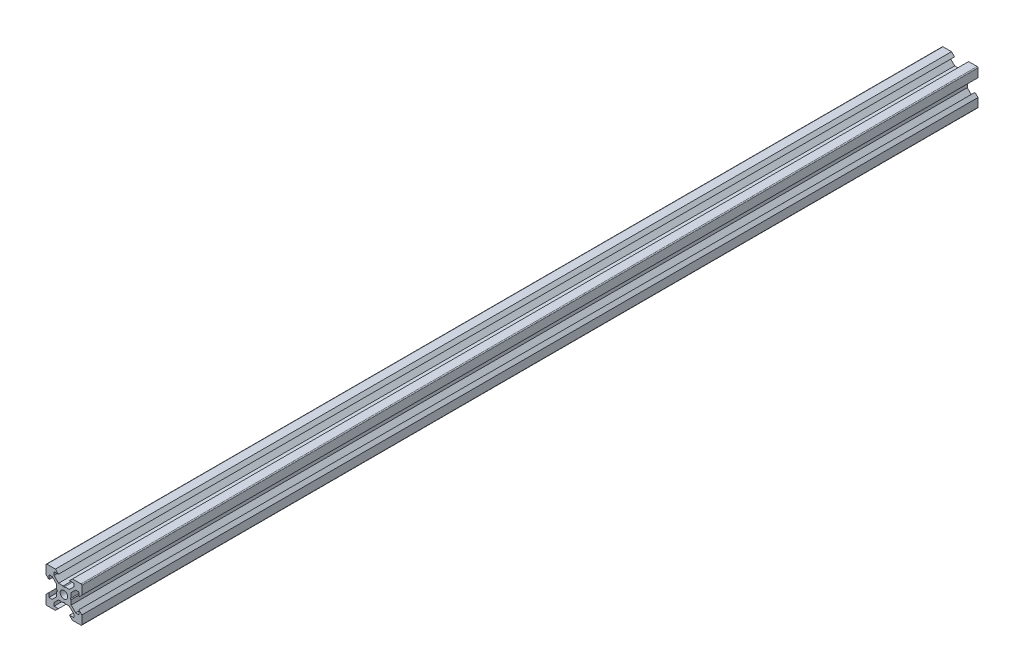
from build123d import *

# Parameters (mm, degrees)
SKETCH1_R           = 2.1
BOSS_EXTRUDE1_DEPTH = 500
FILLET1_R           = 0.5
CUT_EXTRUDE1_DEPTH  = 501.199960016


with BuildPart() as part:
    # Sketch1 → Boss-Extrude1 (new body)
    with BuildSketch(Plane.XY):
        Polygon((-10, 10), (-4.775, 10), (-3.1, 8.325), (-5.5, 8.325), (-5.5, 6.525), (-3, 4.025), (3, 4.025), (5.5, 6.525), (5.5, 8.325), (3.1, 8.325), (4.775, 10), (10, 10), (10, 4.775), (8.325, 3.1), (8.325, 5.5), (6.525, 5.5), (4.025, 3), (4.025, -3), (6.525, -5.5), (8.325, -5.5), (8.325, -3.1), (10, -4.775), (10, -10), (4.775, -10), (3.1, -8.325), (5.5, -8.325), (5.5, -6.525), (3, -4.025), (-3, -4.025), (-5.5, -6.525), (-5.5, -8.325), (-3.1, -8.325), (-4.775, -10), (-10, -10), (-10, -4.775), (-8.325, -3.1), (-8.325, -5.5), (-6.525, -5.5), (-4.025, -3), (-4.025, 3), (-6.525, 5.5), (-8.325, 5.5), (-8.325, 3.1), (-10, 4.775), align=None)
        Circle(SKETCH1_R, mode=Mode.SUBTRACT)
    extrude(amount=BOSS_EXTRUDE1_DEPTH)

    # Fillet1
    fillet1_edges = [part.edges().sort_by_distance(p)[0] for p in [
        (10, -10, 250),
        (-10, -10, 250),
        (-10, 10, 250),
        (10, 10, 250),
    ]]
    fillet(fillet1_edges, radius=FILLET1_R)

    # Sketch2 → Cut-Extrude1 (cut, through all)
    with BuildSketch(Plane.XY.offset(500)):
        with BuildLine():
            ThreePointArc((-4.025, 0.4), (-4.425, 0), (-4.025, -0.4))
            Line((-4.025, -0.4), (-4.025, 0.4))
        make_face()
        with BuildLine():
            Line((-4.025, 0.4), (-4.025, -0.4))
            ThreePointArc((-4.025, -0.4), (-3.742157288, -0.282842712), (-3.625, 0))
            ThreePointArc((-3.625, 0), (-3.742157288, 0.282842712), (-4.025, 0.4))
        make_face()
        with BuildLine():
            ThreePointArc((0.4, 4.025), (0, 4.425), (-0.4, 4.025))
            Line((-0.4, 4.025), (0.4, 4.025))
        make_face()
        with BuildLine():
            Line((0.4, 4.025), (-0.4, 4.025))
            ThreePointArc((-0.4, 4.025), (0, 3.625), (0.4, 4.025))
        make_face()
        with BuildLine():
            ThreePointArc((4.025, 0.4), (3.625, 0), (4.025, -0.4))
            Line((4.025, -0.4), (4.025, 0.4))
        make_face()
        with BuildLine():
            Line((4.025, 0.4), (4.025, -0.4))
            ThreePointArc((4.025, -0.4), (4.307842712, -0.282842712), (4.425, 0))
            ThreePointArc((4.425, 0), (4.307842712, 0.282842712), (4.025, 0.4))
        make_face()
        with BuildLine():
            ThreePointArc((0.4, -4.025), (0, -3.625), (-0.4, -4.025))
            Line((-0.4, -4.025), (0.4, -4.025))
        make_face()
        with BuildLine():
            Line((0.4, -4.025), (-0.4, -4.025))
            ThreePointArc((-0.4, -4.025), (0, -4.425), (0.4, -4.025))
        make_face()
    extrude(amount=-CUT_EXTRUDE1_DEPTH, mode=Mode.SUBTRACT)


solid = part.part
